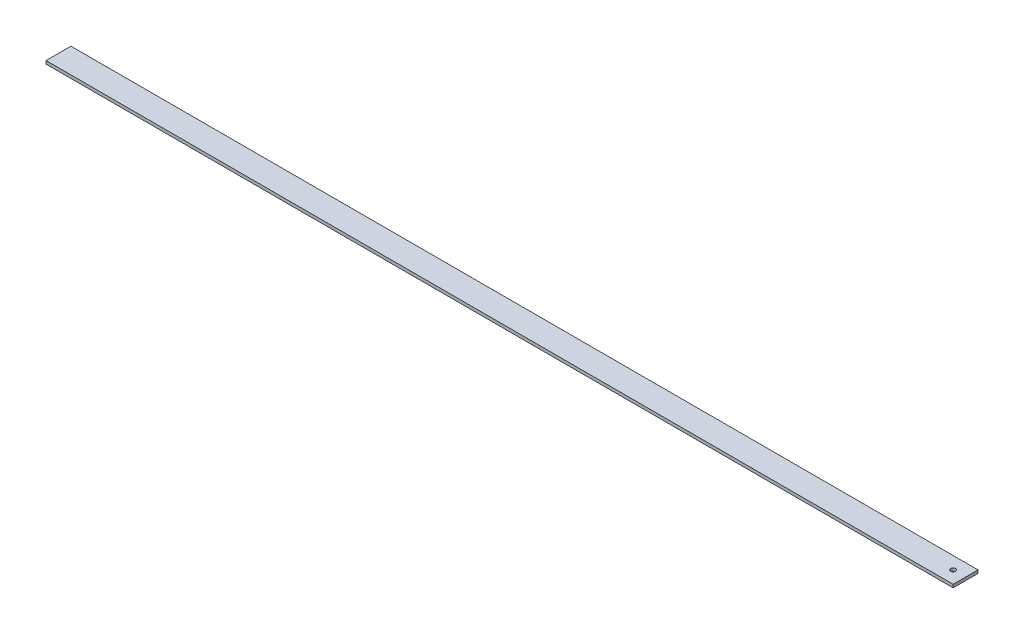
from build123d import *

# Parameters (mm, degrees)
SALIENTE_EXTRUIR1_DEPTH    = 6.31
SALIENTE_EXTRUIR2_DEPTH    = 50.8
SALIENTE_EXTRUIR3_DEPTH    = 50.8
CROQUIS4_W                 = 50.8
CROQUIS4_H                 = 6.31
SALIENTE_EXTRUIR4_DEPTH    = 50.8
CROQUIS7_R                 = 5
CORTAR_EXTRUIR3_DEPTH      = 50
CROQUIS8_R                 = 5
CORTAR_EXTRUIR4_DEPTH      = 24
CROQUIS9_W                 = 50.8
CROQUIS9_H                 = 6.31
SALIENTE_EXTRUIR5_DEPTH    = 6.45
CORTAR_EXTRUIR6_DEPTH      = 108
CORTAR_EXTRUIR7_DEPTH      = 108
CORTAR_EXTRUIR7_DEPTH_BACK = 108
CROQUIS12_W                = 50.8
CROQUIS12_H                = 198.902795


with BuildPart() as part:
    # Croquis1 → Saliente-Extruir1 (new body)
    with BuildSketch(Plane(origin=(0, 0, 0), x_dir=(1, 0, 0), z_dir=(0, 1, 0))):
        Polygon((1742.85, -198.902795), (1742.85, -249.702795), (-50.8, -249.702795), (-50.8, 0), (0, 0), (0, -198.902795), align=None)
    extrude(amount=SALIENTE_EXTRUIR1_DEPTH)

    # Croquis2 → Saliente-Extruir2 (add)
    with BuildSketch(Plane.ZY.offset(50.8)):
        Polygon((0, 6.31), (0, 132.55), (-32.572440357, 197.880208397), (-26.925404535, 200.695716598), (6.31, 134.035807771), (6.31, 6.31), align=None)
    extrude(amount=-SALIENTE_EXTRUIR2_DEPTH)

    # Croquis4 → Saliente-Extruir4 (add)
    with BuildSketch(Plane(origin=(1742.85, 0, 0), x_dir=(0, 0, -1), z_dir=(1, 0, 0))):
        with Locations((-224.302795, 3.155)):
            Rectangle(CROQUIS4_W, CROQUIS4_H)
    extrude(amount=SALIENTE_EXTRUIR4_DEPTH)

    # Croquis7 → Cortar-Extruir3 (cut)
    with BuildSketch(Plane(origin=(0, 0, 0), x_dir=(-1, 0, 0), z_dir=(0, -1, 0))):
        with Locations((-1774.7, -224.302795)):
            Circle(CROQUIS7_R)
    extrude(amount=-CORTAR_EXTRUIR3_DEPTH, mode=Mode.SUBTRACT)


with BuildPart() as body_2:
    # Croquis3 → Saliente-Extruir3 (new body)
    with BuildSketch(Plane.ZY.offset(50.8)):
        Polygon((6.41, 6.41), (6.41, 134.059354646), (-26.835911099, 200.740336379), (-21.188875277, 203.55584458), (12.72, 135.545162417), (12.72, 6.41), align=None)
    extrude(amount=-SALIENTE_EXTRUIR3_DEPTH)


with BuildPart() as cortar_extruir4_tool:
    # Croquis8 → Cortar-Extruir4 (new body)
    with BuildSketch(Plane.XY.offset(12.72)):
        with Locations((-38.1, 98.1)):
            Circle(CROQUIS8_R)
        with Locations((-12.7, 36.91)):
            Circle(CROQUIS8_R)
    extrude(amount=-CORTAR_EXTRUIR4_DEPTH)


with BuildPart() as part_1:
    add(part.part)

    # Cortar-Extruir4: cut by cortar_extruir4_tool
    add(cortar_extruir4_tool.part, mode=Mode.SUBTRACT)

    # Croquis9 → Saliente-Extruir5 (add)
    with BuildSketch(Plane(origin=(1793.65, 0, 0), x_dir=(0, 0, -1), z_dir=(1, 0, 0))):
        with Locations((-224.302795, 3.155)):
            Rectangle(CROQUIS9_W, CROQUIS9_H)
    extrude(amount=SALIENTE_EXTRUIR5_DEPTH)


with BuildPart() as body_2_1:
    add(body_2.part)

    # Cortar-Extruir4: cut by cortar_extruir4_tool
    add(cortar_extruir4_tool.part, mode=Mode.SUBTRACT)


with BuildPart() as cortar_extruir6_tool:
    # Croquis11 → Cortar-Extruir6 (new body)
    with BuildSketch(Plane.XY.offset(12.72)):
        Polygon((-50.8, 6.41), (0, 6.31), (0, 211.944922599), (-50.8, 211.944922599), align=None)
    extrude(amount=-CORTAR_EXTRUIR6_DEPTH)


with BuildPart() as part_2:
    add(part_1.part)

    # Cortar-Extruir6: cut by cortar_extruir6_tool
    add(cortar_extruir6_tool.part, mode=Mode.SUBTRACT)

    # Croquis12 → Cortar-Extruir7 (cut, two sides: drawn at the far end of the back side and taken through both)
    with BuildSketch(Plane(origin=(0, 6.31, 0), x_dir=(1, 0, 0), z_dir=(0, 1, 0)).offset(-CORTAR_EXTRUIR7_DEPTH_BACK)):
        with Locations((-25.4, -99.4513975)):
            Rectangle(CROQUIS12_W, CROQUIS12_H)
    extrude(amount=CORTAR_EXTRUIR7_DEPTH + CORTAR_EXTRUIR7_DEPTH_BACK, mode=Mode.SUBTRACT)


with BuildPart() as body_2_2:
    add(body_2_1.part)

    # Cortar-Extruir6: cut by cortar_extruir6_tool
    add(cortar_extruir6_tool.part, mode=Mode.SUBTRACT)


solid = part_2.part
